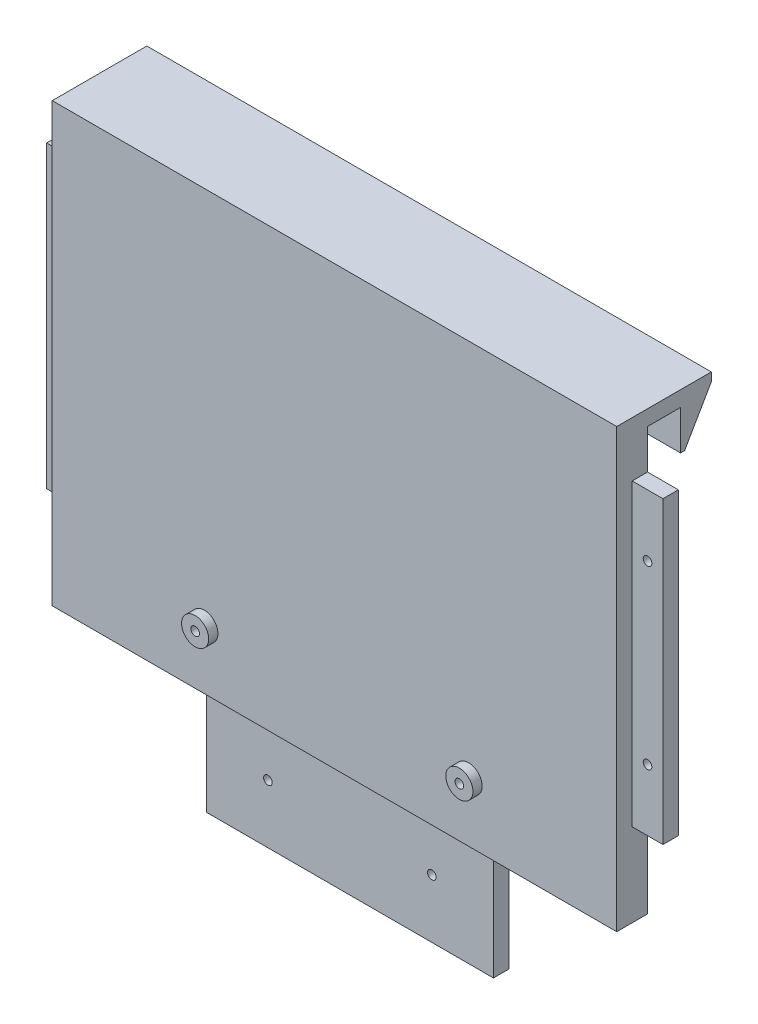
from build123d import *

# Parameters (mm, degrees)
CROQUIS1_W              = 180
CROQUIS1_H              = 180
SALIENTE_EXTRUIR1_DEPTH = 30.7
CROQUIS2_W              = 180
CROQUIS2_H              = 162.21
CORTAR_EXTRUIR1_DEPTH   = 20.7
CROQUIS3_W              = 10.7
CROQUIS3_H              = 12.79
CORTAR_EXTRUIR2_DEPTH   = 274.7
SALIENTE_EXTRUIR2_DEPTH = 20
CROQUIS5_W              = 10
CROQUIS5_H              = 17.79
CROQUIS5_W_2            = 6.8
CORTAR_EXTRUIR3_DEPTH   = 30.7
CROQUIS6_W              = 6.8
CROQUIS6_H              = 97.21
CROQUIS6_W_2            = 10
CROQUIS6_W_3            = 93.2
CROQUIS6_H_2            = 38
CORTAR_EXTRUIR4_DEPTH   = 5
CHAFL_N1_SIZE           = 15
CHAFL_N1_SIZE2          = 8.660254038
CROQUIS7_R              = 1.4
CORTAR_EXTRUIR5_DEPTH   = 20
CROQUIS8_R              = 4.4
CROQUIS8_R_2            = 1.4
SALIENTE_EXTRUIR3_DEPTH = 3


with BuildPart() as part:
    # Croquis1 → Saliente-Extruir1 (new body)
    with BuildSketch(Plane.XY):
        with Locations((90, 90)):
            Rectangle(CROQUIS1_W, CROQUIS1_H)
    extrude(amount=SALIENTE_EXTRUIR1_DEPTH)

    # Croquis2 → Cortar-Extruir1 (cut)
    with BuildSketch(Plane(origin=(0, 0, 0), x_dir=(-1, 0, 0), z_dir=(0, 0, -1))):
        with Locations((-90, 81.105)):
            Rectangle(CROQUIS2_W, CROQUIS2_H)
    extrude(amount=-CORTAR_EXTRUIR1_DEPTH, mode=Mode.SUBTRACT)

    # Croquis3 → Cortar-Extruir2 (cut)
    with BuildSketch(Plane.ZY):
        with Locations((15.35, 168.605)):
            Rectangle(CROQUIS3_W, CROQUIS3_H)
    extrude(amount=-CORTAR_EXTRUIR2_DEPTH, mode=Mode.SUBTRACT)

    # Croquis4 → Saliente-Extruir2 (add)
    with BuildSketch(Plane(origin=(180, 0, 0), x_dir=(0, 0, -1), z_dir=(1, 0, 0))):
        Polygon((-20.7, 0), (-20.7, 175), (-10, 175), (-10, 162.21), (0, 162.21), (0, 180), (-30.7, 180), (-30.7, 0), align=None)
    extrude(amount=SALIENTE_EXTRUIR2_DEPTH)

    # Croquis5 → Cortar-Extruir3 (cut)
    with BuildSketch(Plane.XY.offset(30.7)):
        Polygon((0, 0), (6.8, 0), (51.8, 0), (51.8, 38), (6.8, 38), (6.8, 65), (0, 65), align=None)
        Polygon((200, 0), (190, 0), (145, 0), (145, 38), (190, 38), (190, 65), (200, 65), align=None)
        with Locations((195, 171.105)):
            Rectangle(CROQUIS5_W, CROQUIS5_H)
        with Locations((3.4, 171.105)):
            Rectangle(CROQUIS5_W_2, CROQUIS5_H)
    extrude(amount=-CORTAR_EXTRUIR3_DEPTH, mode=Mode.SUBTRACT)

    # Croquis6 → Cortar-Extruir4 (cut)
    with BuildSketch(Plane.XY.offset(30.7)):
        with Locations((3.4, 113.605)):
            Rectangle(CROQUIS6_W, CROQUIS6_H)
        with Locations((195, 113.605)):
            Rectangle(CROQUIS6_W_2, CROQUIS6_H)
        with Locations((98.4, 19)):
            Rectangle(CROQUIS6_W_3, CROQUIS6_H_2)
    extrude(amount=-CORTAR_EXTRUIR4_DEPTH, mode=Mode.SUBTRACT)

    # Chaflán1
    chafl_n1_edges = [part.edges().sort_by_distance(p)[0] for p in [
        (98.4, 162.21, 0),
    ]]
    chafl_n1_side = [part.faces().sort_by_distance(p)[0] for p in [
        (98.4, 171.105, 0),
    ]]
    chamfer(chafl_n1_edges, length=CHAFL_N1_SIZE, length2=CHAFL_N1_SIZE2, reference=chafl_n1_side[0])

    # Croquis7 → Cortar-Extruir5 (cut)
    with BuildSketch(Plane.XY.offset(30.7)):
        with Locations((125, 19)):
            Circle(CROQUIS7_R)
        with Locations((71.8, 19)):
            Circle(CROQUIS7_R)
        with Locations((195, 85)):
            Circle(CROQUIS7_R)
        with Locations((195, 142.21)):
            Circle(CROQUIS7_R)
        with Locations(Location((3.4, 142.21, 0), (0, 0, 180))):
            Circle(CROQUIS7_R)
        with Locations(Location((3.4, 85, 0), (0, 0, 180))):
            Circle(CROQUIS7_R)
    extrude(amount=-CORTAR_EXTRUIR5_DEPTH, mode=Mode.SUBTRACT)

    # Croquis8 → Saliente-Extruir3 (add)
    # profile 1 of 2: a face of its own
    with BuildSketch(Plane.XY.offset(30.7)):
        with Locations(Location((56.17, 57.07, 0), (0, 0, 180))):
            Circle(CROQUIS8_R)
        with Locations((56.17, 57.07)):
            Circle(CROQUIS8_R_2, mode=Mode.SUBTRACT)
    # profile 2 of 2: a face of its own
    with BuildSketch(Plane.XY.offset(30.7)):
        with Locations(Location((141.93, 57.07, 0), (0, 0, 180))):
            Circle(CROQUIS8_R)
        with Locations((141.93, 57.07)):
            Circle(CROQUIS8_R_2, mode=Mode.SUBTRACT)
    extrude(amount=SALIENTE_EXTRUIR3_DEPTH)


solid = part.part
